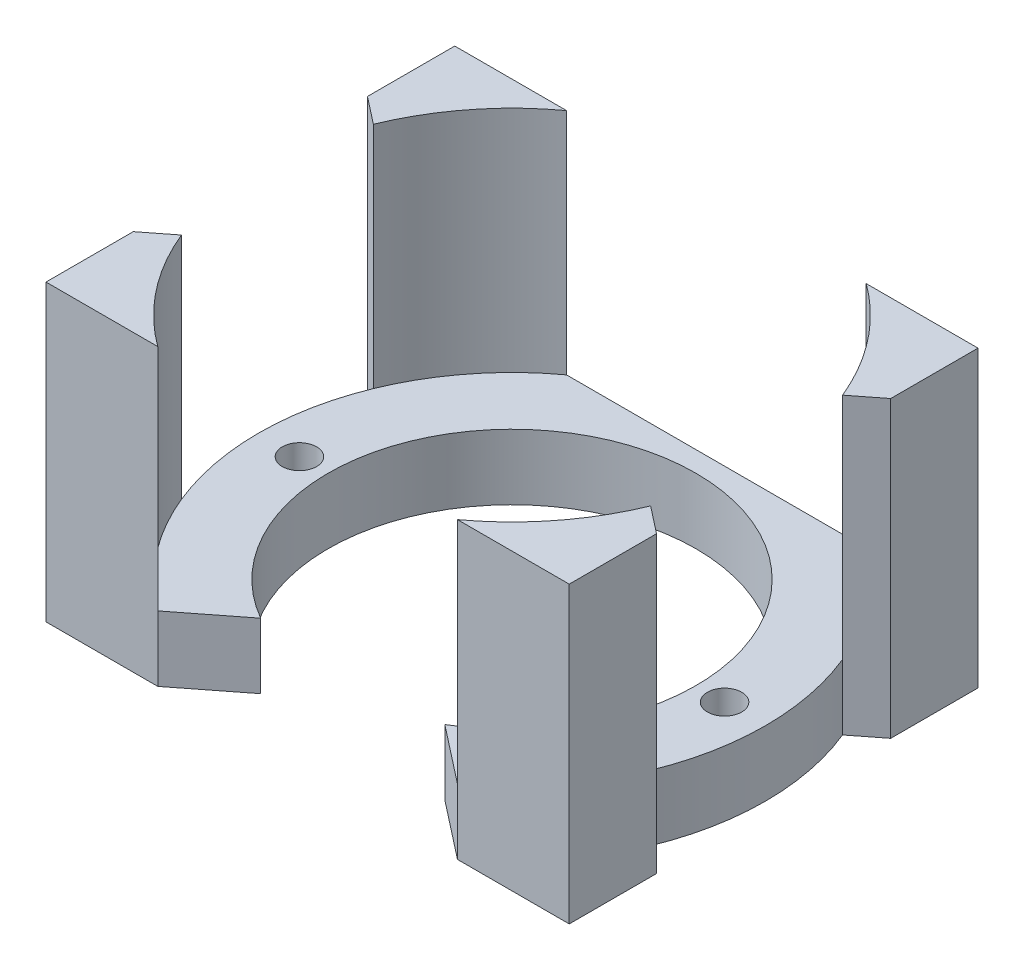
from build123d import *

# Parameters (mm, degrees)
SKETCH1_R           = 2.1
BOSS_EXTRUDE1_DEPTH = 8
BOSS_EXTRUDE2_DEPTH = 36


with BuildPart() as part:
    # Sketch1 → Boss-Extrude1 (new body)
    with BuildSketch(Plane(origin=(0, 0, 0), x_dir=(1, 0, 0), z_dir=(0, 1, 0))):
        with BuildLine():
            Line((18.33030278, -25), (32, -25))
            Line((32, -25), (32, -14.320549047))
            Line((32, -14.320549047), (28.692414075, -11.736497543))
            ThreePointArc((28.692414075, -11.736497543), (31, 0), (28.692414075, 11.736497543))
            Line((28.692414075, 11.736497543), (32, 14.320549047))
            Line((32, 14.320549047), (32, 25))
            Line((32, 25), (-32, 25))
            Line((-32, 25), (-32, 14.320549047))
            Line((-32, 14.320549047), (-28.692414075, 11.736497543))
            ThreePointArc((-28.692414075, 11.736497543), (-31, 0), (-28.692414075, -11.736497543))
            Line((-28.692414075, -11.736497543), (-32, -14.320549047))
            Line((-32, -14.320549047), (-32, -25))
            Line((-32, -25), (-18.33030278, -25))
            Line((-18.33030278, -25), (-11.262551698, -19.478319467))
            ThreePointArc((-11.262551698, -19.478319467), (0, 22.5), (11.262551698, -19.478319467))
            Line((11.262551698, -19.478319467), (18.33030278, -25))
        make_face()
        with Locations(Location((26, 0, 0), (0, 0, 270))):
            Circle(SKETCH1_R, mode=Mode.SUBTRACT)
        with Locations(Location((-26, 0, 0), (0, 0, 270))):
            Circle(SKETCH1_R, mode=Mode.SUBTRACT)
    extrude(amount=BOSS_EXTRUDE1_DEPTH)

    # Sketch1<4> → Boss-Extrude2 (add)
    with BuildSketch(Plane(origin=(0, 0, 0), x_dir=(1, 0, 0), z_dir=(0, 1, 0))):
        with BuildLine():
            Line((28.692414075, 11.736497543), (32, 14.320549047))
            Line((32, 14.320549047), (32, 25))
            Line((32, 25), (18.33030278, 25))
            ThreePointArc((18.33030278, 25), (24.428755585, 19.084965301), (28.692414075, 11.736497543))
        make_face()
        with BuildLine():
            Line((-32, 25), (-32, 14.320549047))
            Line((-32, 14.320549047), (-28.692414075, 11.736497543))
            ThreePointArc((-28.692414075, 11.736497543), (-24.428755585, 19.084965301), (-18.33030278, 25))
            Line((-18.33030278, 25), (-32, 25))
        make_face()
        with BuildLine():
            Line((-32, -14.320549047), (-32, -25))
            Line((-32, -25), (-24.428755585, -19.084965301))
            ThreePointArc((-24.428755585, -19.084965301), (-26.813516388, -15.557484979), (-28.692414075, -11.736497543))
            Line((-28.692414075, -11.736497543), (-32, -14.320549047))
        make_face()
        with BuildLine():
            Line((-32, -25), (-18.33030278, -25))
            ThreePointArc((-18.33030278, -25), (-21.583122502, -22.252389154), (-24.428755585, -19.084965301))
            Line((-24.428755585, -19.084965301), (-32, -25))
        make_face()
        with BuildLine():
            Line((18.33030278, -25), (32, -25))
            Line((32, -25), (32, -14.320549047))
            Line((32, -14.320549047), (28.692414075, -11.736497543))
            ThreePointArc((28.692414075, -11.736497543), (24.428755585, -19.084965301), (18.33030278, -25))
        make_face()
    extrude(amount=BOSS_EXTRUDE2_DEPTH)


solid = part.part
